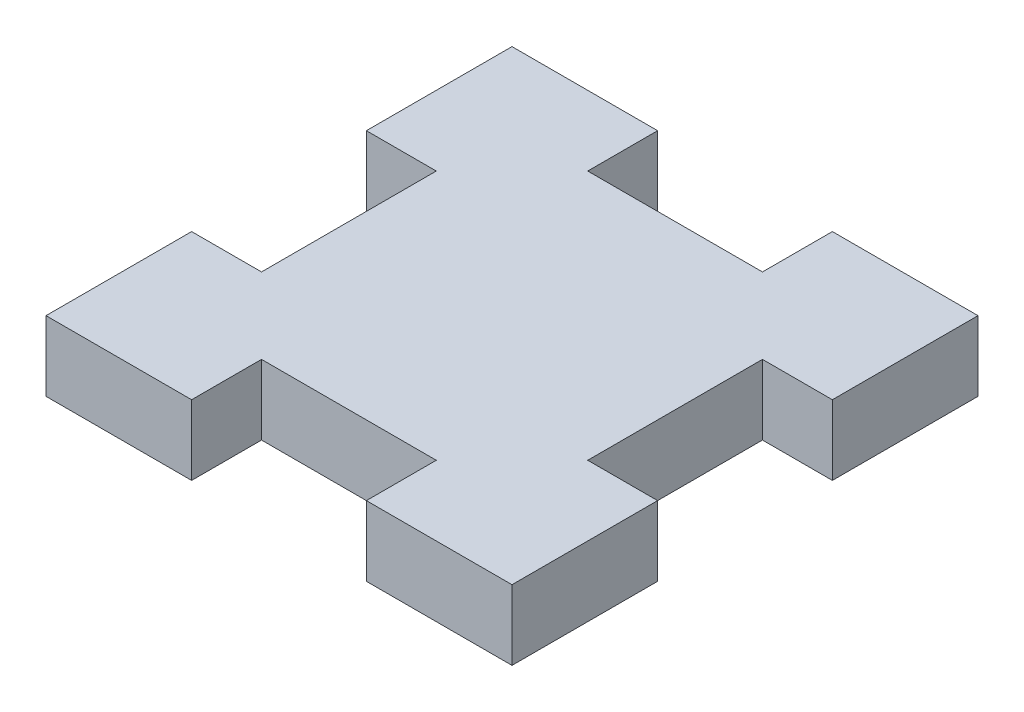
from build123d import *

# Parameters (mm, degrees)
SALIENTE_EXTRUIR1_DEPTH = 6


with BuildPart() as part:
    # Croquis1 → Saliente-Extruir1 (new body)
    with BuildSketch(Plane(origin=(0, 0, 0), x_dir=(1, 0, 0), z_dir=(0, 1, 0))):
        Polygon((0, 12.5), (0, 0), (12.5, 0), (12.5, 6), (27.5, 6), (27.5, 0), (40, 0), (40, 12.5), (34, 12.5), (34, 27.5), (40, 27.5), (40, 40), (27.5, 40), (27.5, 34), (12.5, 34), (12.5, 40), (0, 40), (0, 27.5), (6, 27.5), (6, 12.5), align=None)
    extrude(amount=SALIENTE_EXTRUIR1_DEPTH)


solid = part.part
